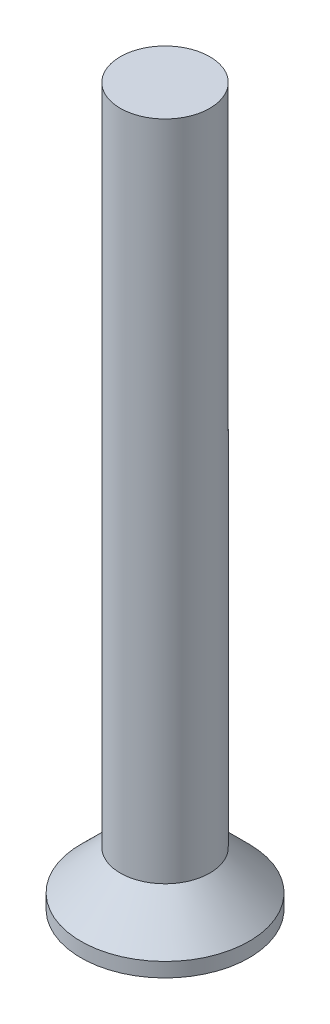
from build123d import *

# Parameters (mm, degrees)
SKETCH1_R           = 1.25
BOSS_EXTRUDE1_DEPTH = 20
CUT_EXTRUDE1_DEPTH  = 0.5


with BuildPart() as part:
    # Sketch1 → Boss-Extrude1 (new body)
    with BuildSketch(Plane(origin=(0, 0, 0), x_dir=(1, 0, 0), z_dir=(0, 1, 0))):
        with Locations(Location((0, 0, 0), (0, 0, 270))):
            Circle(SKETCH1_R)
    extrude(amount=BOSS_EXTRUDE1_DEPTH)

    # Sketch2 → Revolve1 (revolve)
    with BuildSketch(Plane(origin=(0, 0, 0), x_dir=(0, 0, -1), z_dir=(1, 0, 0)), mode=Mode.PRIVATE) as revolve1_sk:
        Polygon((0, 0), (0, 1.5), (-1.25, 1.5), (-2.35, 0.4), (-2.35, 0), align=None)
    revolve(revolve1_sk.sketch.rotate(Axis((0, -0.5, 0), (0, 1, 0)), 180), axis=Axis((0, -0.5, 0), (0, 1, 0)))

    # Sketch3 → Cut-Extrude1 (cut)
    with BuildSketch(Plane.XZ):
        Polygon((-1.5, -0.25), (-0.25, -0.25), (-0.25, -1.5), (0.25, -1.5), (0.25, -0.25), (1.5, -0.25), (1.5, 0.25), (0.25, 0.25), (0.25, 1.5), (-0.25, 1.5), (-0.25, 0.25), (-1.5, 0.25), align=None)
    extrude(amount=-CUT_EXTRUDE1_DEPTH, mode=Mode.SUBTRACT)


solid = part.part
